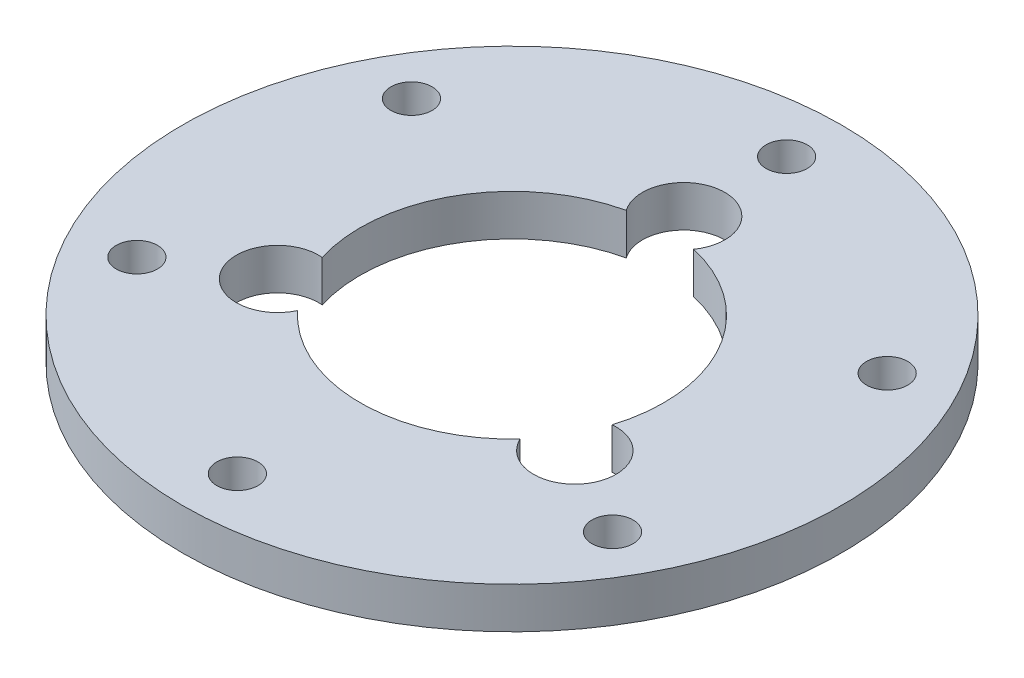
from build123d import *

# Parameters (mm, degrees)
SKETCH_1_R          = 24
SKETCH_1_R_2        = 11.05
SKETCH_1_R_3        = 1.5
SKETCH_1_R_4        = 1.4
EXTRUDE_1_DEPTH     = 3
SKETCH_2_R          = 3
CUT_EXTRUDE_1_DEPTH = 10


with BuildPart() as part:
    # 草图1 → 凸台-拉伸1 (new body)
    with BuildSketch(Plane(origin=(0, 0, 0), x_dir=(1, 0, 0), z_dir=(0, 1, 0))):
        with Locations(Location((0, 0, 0), (0, 0, 270))):
            Circle(SKETCH_1_R)
        with Locations(Location((0, 0, 0), (0, 0, 270))):
            Circle(SKETCH_1_R_2, mode=Mode.SUBTRACT)
        with Locations(Location((0, 20, 0), (0, 0, 270))):
            Circle(SKETCH_1_R_3, mode=Mode.SUBTRACT)
        with Locations(Location((0, 12.5, 0), (0, 0, 270))):
            Circle(SKETCH_1_R_4, mode=Mode.SUBTRACT)
        with Locations(Location((17.320508076, 10, 0), (0, 0, 270))):
            Circle(SKETCH_1_R_3, mode=Mode.SUBTRACT)
        with Locations(Location((17.320508076, -10, 0), (0, 0, 270))):
            Circle(SKETCH_1_R_3, mode=Mode.SUBTRACT)
        with Locations(Location((0, -20, 0), (0, 0, 270))):
            Circle(SKETCH_1_R_3, mode=Mode.SUBTRACT)
        with Locations(Location((-17.320508076, -10, 0), (0, 0, 270))):
            Circle(SKETCH_1_R_3, mode=Mode.SUBTRACT)
        with Locations(Location((-17.320508076, 10, 0), (0, 0, 270))):
            Circle(SKETCH_1_R_3, mode=Mode.SUBTRACT)
        with Locations(Location((10.825317547, -6.25, 0), (0, 0, 270))):
            Circle(SKETCH_1_R_4, mode=Mode.SUBTRACT)
        with Locations(Location((-10.825317547, -6.25, 0), (0, 0, 270))):
            Circle(SKETCH_1_R_4, mode=Mode.SUBTRACT)
    extrude(amount=EXTRUDE_1_DEPTH)

    # 草图2 → 切除-拉伸1 (cut)
    with BuildSketch(Plane.XZ):
        with Locations((10.825317547, 6.25)):
            Circle(SKETCH_2_R)
        with Locations((-10.825317547, 6.25)):
            Circle(SKETCH_2_R)
        with Locations((0, -12.5)):
            Circle(SKETCH_2_R)
    extrude(amount=-CUT_EXTRUDE_1_DEPTH, mode=Mode.SUBTRACT)


solid = part.part
